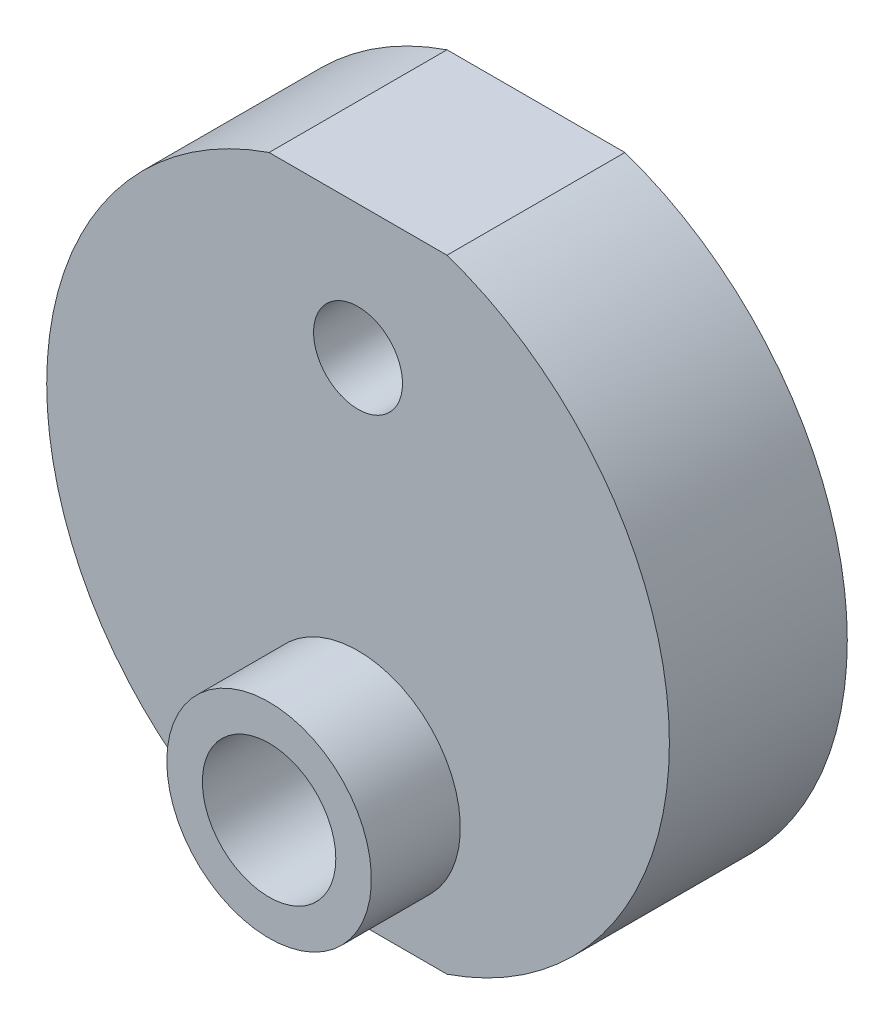
from build123d import *

# Parameters (mm, degrees)
MODEL_R             = 3.175
MODEL_R_2           = 4.7625
BOSS_EXTRUDE1_DEPTH = 12.7
MODEL_3_R           = 7.3025
MODEL_3_R_2         = 4.7625
BOSS_EXTRUDE2_DEPTH = 19.05


with BuildPart() as part:
    # Model → Boss-Extrude1 (new body)
    with BuildSketch(Plane.XY):
        with BuildLine():
            Line((264.921999997, 211.709), (277.621999997, 211.709))
            ThreePointArc((277.621999997, 211.709), (293.497000017, 233.934), (277.621999997, 256.159))
            Line((277.621999997, 256.159), (264.921999997, 256.159))
            ThreePointArc((264.921999997, 256.159), (249.046999977, 233.934), (264.921999997, 211.709))
        make_face()
        with Locations((271.271999997, 246.634)):
            Circle(MODEL_R, mode=Mode.SUBTRACT)
        with Locations((271.271999997, 221.234)):
            Circle(MODEL_R_2, mode=Mode.SUBTRACT)
    extrude(amount=BOSS_EXTRUDE1_DEPTH)

    # Model<3> → Boss-Extrude2 (add)
    with BuildSketch(Plane.XY):
        with Locations((271.271999997, 221.234)):
            Circle(MODEL_3_R)
        with Locations((271.271999997, 221.234)):
            Circle(MODEL_3_R_2, mode=Mode.SUBTRACT)
    extrude(amount=BOSS_EXTRUDE2_DEPTH)


solid = part.part
